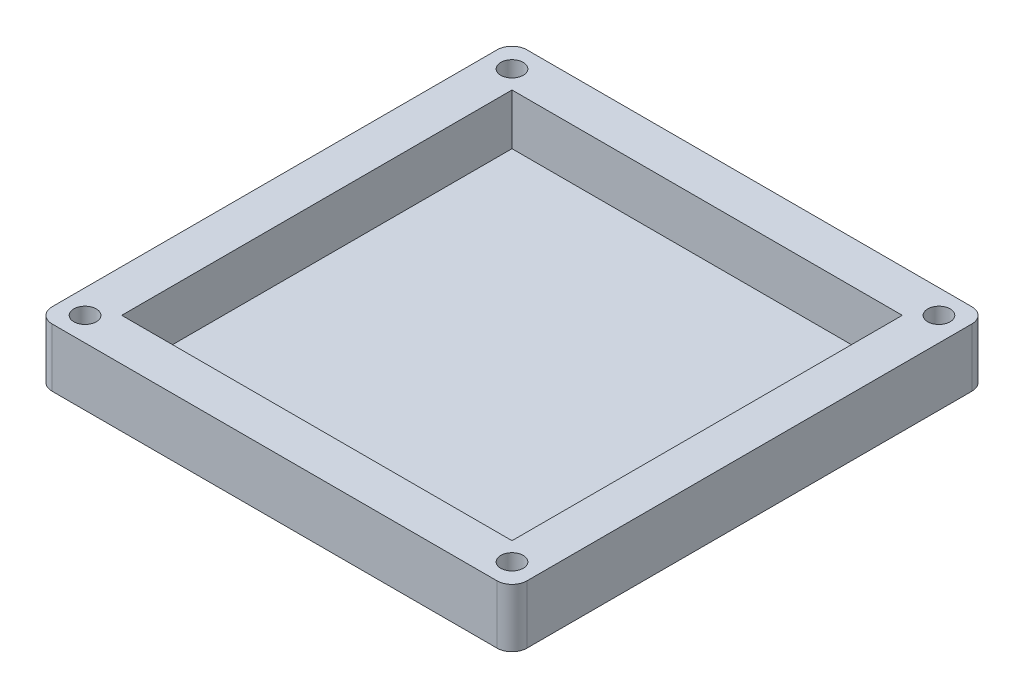
from build123d import *

# Parameters (mm, degrees)
SKETCH1_W           = 63.5
SKETCH1_H           = 63.5
BOSS_EXTRUDE1_DEPTH = 7.8
SKETCH2_W           = 52.2
SKETCH2_H           = 52.2
CUT_EXTRUDE1_DEPTH  = 6.8
SKETCH3_R           = 1.5
CUT_EXTRUDE2_DEPTH  = 7.5
FILLET1_R           = 2


with BuildPart() as part:
    # Sketch1 → Boss-Extrude1 (new body)
    with BuildSketch(Plane(origin=(0, 0, 0), x_dir=(1, 0, 0), z_dir=(0, 1, 0))):
        with Locations((31.75, 31.75)):
            Rectangle(SKETCH1_W, SKETCH1_H)
    extrude(amount=BOSS_EXTRUDE1_DEPTH)

    # Sketch2 → Cut-Extrude1 (cut)
    with BuildSketch(Plane(origin=(0, 7.8, 0), x_dir=(1, 0, 0), z_dir=(0, 1, 0))):
        with Locations((31.75, 31.75)):
            Rectangle(SKETCH2_W, SKETCH2_H)
    extrude(amount=-CUT_EXTRUDE1_DEPTH, mode=Mode.SUBTRACT)

    # Sketch3 → Cut-Extrude2 (cut)
    with BuildSketch(Plane(origin=(0, 7.8, 0), x_dir=(1, 0, 0), z_dir=(0, 1, 0))):
        with Locations(Location((3.2, 3.2, 0), (0, 0, 270))):
            Circle(SKETCH3_R)
        with Locations(Location((3.2, 60.3, 0), (0, 0, 270))):
            Circle(SKETCH3_R)
        with Locations(Location((60.3, 60.3, 0), (0, 0, 270))):
            Circle(SKETCH3_R)
        with Locations(Location((60.3, 3.2, 0), (0, 0, 270))):
            Circle(SKETCH3_R)
    extrude(amount=-CUT_EXTRUDE2_DEPTH, mode=Mode.SUBTRACT)

    # Fillet1
    fillet1_edges = [part.edges().sort_by_distance(p)[0] for p in [
        (0, 3.9, -63.5),
        (63.5, 3.9, -63.5),
        (63.5, 3.9, 0),
        (0, 3.9, 0),
    ]]
    fillet(fillet1_edges, radius=FILLET1_R)


solid = part.part
